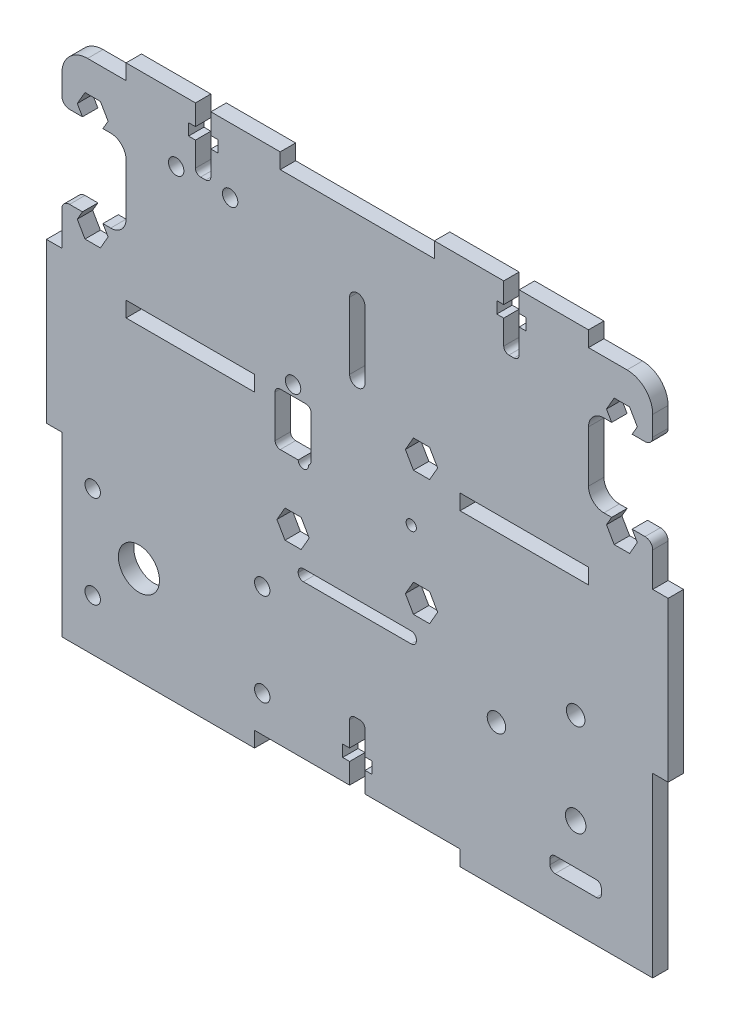
from build123d import *

# Parameters (mm, degrees)
ESBO_O1_W                   = 115
ESBO_O1_H                   = 100
RESSALTO_EXTRUS_O1_DEPTH    = 1.5
ESBO_O2_W                   = 40
ESBO_O2_H                   = 3
ESBO_O2_W_2                 = 25
CORTE_EXTRUS_O1_DEPTH       = 77.257786488
CUT_EXTRUDE12_DEPTH         = 77.213515862
CUT_EXTRUDE12_DEPTH_BACK    = 77.213515862
ESBO_O3_W                   = 3
ESBO_O3_H                   = 31
ESBO_O3_W_2                 = 30
ESBO_O3_H_2                 = 3
RESSALTO_EXTRUS_O2_DEPTH    = 3
CORTE_EXTRUS_O11_DEPTH      = 81.487576681
CORTE_EXTRUS_O11_DEPTH_BACK = 81.487576681
ESBO_O30_R                  = 4
ESBO_O4_R                   = 2
CORTE_EXTRUS_O2_DEPTH       = 81.487576681
CORTE_EXTRUS_O12_DEPTH      = 81.487576681
CORTE_EXTRUS_O12_DEPTH_BACK = 81.487576681
ESBO_O31_R                  = 1.5
CUT_EXTRUDE14_DEPTH         = 81.445633816
CUT_EXTRUDE14_DEPTH_BACK    = 81.445633816
CUT_EXTRUDE16_DEPTH         = 81.445633816
CUT_EXTRUDE16_DEPTH_BACK    = 81.445633816
SKETCH13_R                  = 1.5
CORTE_EXTRUS_O13_DEPTH      = 81.487576681
CORTE_EXTRUS_O13_DEPTH_BACK = 81.487576681
ESBO_O34_R                  = 1
CUT_EXTRUDE15_DEPTH         = 81.487576681
SKETCH12_3_W                = 4
SKETCH12_3_H                = 0.5
CUT_EXTRUDE18_DEPTH         = 0.1
FILLET1_R                   = 5
CUT_EXTRUDE17_DEPTH         = 81.445633816
CUT_EXTRUDE17_DEPTH_BACK    = 81.445633816
SKETCH14_R                  = 1.5
CUT_EXTRUDE19_DEPTH         = 81.487576681
CUT_EXTRUDE19_DEPTH_BACK    = 81.487576681
FILLET3_R                   = 1.5
CUT_EXTRUDE20_DEPTH         = 81.487576681
CUT_EXTRUDE20_DEPTH_BACK    = 81.487576681
SKETCH17_R                  = 1.8


with BuildPart() as part:
    # Esboço1 → Ressalto-extrusão1 (new, symmetric)
    with BuildSketch(Plane.XY):
        Rectangle(ESBO_O1_W, ESBO_O1_H)
    extrude(amount=RESSALTO_EXTRUS_O1_DEPTH, both=True)

    # Esboço2 → Corte-extrusão1 (cut, through all)
    with BuildSketch(Plane.XY.offset(1.5)):
        with Locations((0, -48.5)):
            Rectangle(ESBO_O2_W, ESBO_O2_H)
        with Locations((-32.5, 11.5)):
            Rectangle(ESBO_O2_W_2, ESBO_O2_H)
        with Locations((32.5, 11.5)):
            Rectangle(ESBO_O2_W_2, ESBO_O2_H)
    extrude(amount=-CORTE_EXTRUS_O1_DEPTH, mode=Mode.SUBTRACT)

    # Sketch9 → Cut-Extrude12 (cut, two sides: drawn at the far end of the back side and taken through both)
    with BuildSketch(Plane.XY.offset(-CUT_EXTRUDE12_DEPTH_BACK)):
        with BuildLine():
            Line((-1.5, -47), (1.5, -47))
            Line((1.5, -47), (1.5, -43))
            Line((1.5, -43), (2.85, -43))
            Line((2.85, -43), (2.85, -40.73))
            Line((2.85, -40.73), (1.5, -40.73))
            Line((1.5, -40.73), (1.5, -36))
            ThreePointArc((1.5, -36), (1.207106781, -35.292893219), (0.5, -35))
            Line((0.5, -35), (-0.5, -35))
            ThreePointArc((-0.5, -35), (-1.207106781, -35.292893219), (-1.5, -36))
            Line((-1.5, -36), (-1.5, -40.73))
            Line((-1.5, -40.73), (-2.85, -40.73))
            Line((-2.85, -40.73), (-2.85, -43))
            Line((-2.85, -43), (-1.5, -43))
            Line((-1.5, -43), (-1.5, -47))
        make_face()
    extrude(amount=CUT_EXTRUDE12_DEPTH + CUT_EXTRUDE12_DEPTH_BACK, mode=Mode.SUBTRACT)

    # Esboço3 → Ressalto-extrusão2 (add, through all)
    with BuildSketch(Plane.XY.offset(1.5)):
        with Locations((59, 0)):
            Rectangle(ESBO_O3_W, ESBO_O3_H)
        with Locations((-59, 0)):
            Rectangle(ESBO_O3_W, ESBO_O3_H)
        with Locations((-30, 51.5)):
            Rectangle(ESBO_O3_W_2, ESBO_O3_H_2)
        with Locations((30, 51.5)):
            Rectangle(ESBO_O3_W_2, ESBO_O3_H_2)
    extrude(amount=-RESSALTO_EXTRUS_O2_DEPTH)

    # Esboço30 → Corte-extrusão11 (cut, two sides: drawn at the far end of the back side and taken through both)
    with BuildSketch(Plane(origin=(0, 0, -1.5), x_dir=(-1, 0, 0), z_dir=(0, 0, -1)).offset(-CORTE_EXTRUS_O11_DEPTH_BACK)):
        with Locations((42.5, -31)):
            Circle(ESBO_O30_R)
    extrude(amount=CORTE_EXTRUS_O11_DEPTH + CORTE_EXTRUS_O11_DEPTH_BACK, mode=Mode.SUBTRACT)

    # Esboço4 → Corte-extrusão2 (cut, through all)
    with BuildSketch(Plane.XY.offset(1.5)):
        with Locations((42.5, -31)):
            Circle(ESBO_O4_R)
    extrude(amount=-CORTE_EXTRUS_O2_DEPTH, mode=Mode.SUBTRACT)

    # Esboço31 → Corte-extrusão12 (cut, two sides: drawn at the far end of the back side and taken through both)
    with BuildSketch(Plane(origin=(0, 0, -1.5), x_dir=(-1, 0, 0), z_dir=(0, 0, -1)).offset(-CORTE_EXTRUS_O12_DEPTH_BACK)):
        with Locations((51.5, -22)):
            Circle(ESBO_O31_R)
        with Locations((51.5, -40)):
            Circle(ESBO_O31_R)
        with Locations((18.5, -22)):
            Circle(ESBO_O31_R)
        with Locations((18.5, -40)):
            Circle(ESBO_O31_R)
    extrude(amount=CORTE_EXTRUS_O12_DEPTH + CORTE_EXTRUS_O12_DEPTH_BACK, mode=Mode.SUBTRACT)

    # Sketch11 → Cut-Extrude14 (cut, two sides: drawn at the far end of the back side and taken through both)
    with BuildSketch(Plane.XY.offset(-CUT_EXTRUDE14_DEPTH_BACK)):
        with BuildLine():
            Line((28.5, 53), (31.5, 53))
            Line((31.5, 53), (31.5, 49))
            Line((31.5, 49), (32.85, 49))
            Line((32.85, 49), (32.85, 46.73))
            Line((32.85, 46.73), (31.5, 46.73))
            Line((31.5, 46.73), (31.5, 42))
            ThreePointArc((31.5, 42), (31.207106781, 41.292893219), (30.5, 41))
            Line((30.5, 41), (29.5, 41))
            ThreePointArc((29.5, 41), (28.792893219, 41.292893219), (28.5, 42))
            Line((28.5, 42), (28.5, 46.73))
            Line((28.5, 46.73), (27.15, 46.73))
            Line((27.15, 46.73), (27.15, 49))
            Line((27.15, 49), (28.5, 49))
            Line((28.5, 49), (28.5, 53))
        make_face()
        with BuildLine():
            Line((-31.5, 46.73), (-32.85, 46.73))
            Line((-32.85, 46.73), (-32.85, 49))
            Line((-32.85, 49), (-31.5, 49))
            Line((-31.5, 49), (-31.5, 53))
            Line((-31.5, 53), (-28.5, 53))
            Line((-28.5, 53), (-28.5, 49))
            Line((-28.5, 49), (-27.15, 49))
            Line((-27.15, 49), (-27.15, 46.73))
            Line((-27.15, 46.73), (-28.5, 46.73))
            Line((-28.5, 46.73), (-28.5, 42))
            ThreePointArc((-28.5, 42), (-28.792893219, 41.292893219), (-29.5, 41))
            Line((-29.5, 41), (-30.5, 41))
            ThreePointArc((-30.5, 41), (-31.207106781, 41.292893219), (-31.5, 42))
            Line((-31.5, 42), (-31.5, 46.73))
        make_face()
    extrude(amount=CUT_EXTRUDE14_DEPTH + CUT_EXTRUDE14_DEPTH_BACK, mode=Mode.SUBTRACT)

    # Sketch13 → Cut-Extrude16 (cut, two sides: drawn at the far end of the back side and taken through both)
    with BuildSketch(Plane.XY.offset(-CUT_EXTRUDE16_DEPTH_BACK)):
        with Locations((-12.5, 15.019319768)):
            Circle(SKETCH13_R)
        with BuildLine():
            Line((-10, 13.019319768), (-15, 13.019319768))
            ThreePointArc((-15, 13.019319768), (-15.707106781, 12.726426549), (-16, 12.019319768))
            Line((-16, 12.019319768), (-16, 3.819319768))
            ThreePointArc((-16, 3.819319768), (-15.707106781, 3.112212987), (-15, 2.819319768))
            Line((-15, 2.819319768), (-10, 2.819319768))
            ThreePointArc((-10, 2.819319768), (-9.292893219, 3.112212987), (-9, 3.819319768))
            Line((-9, 3.819319768), (-9, 12.019319768))
            ThreePointArc((-9, 12.019319768), (-9.292893219, 12.726426549), (-10, 13.019319768))
        make_face()
        Polygon((15.64, 15.019319768), (14.07, 17.738639536), (10.93, 17.738639536), (9.36, 15.019319768), (10.93, 12.3), (14.07, 12.3), align=None)
        Polygon((15.64, -9.280680232), (14.07, -6.561360464), (10.93, -6.561360464), (9.36, -9.280680232), (10.93, -12), (14.07, -12), align=None)
        Polygon((-9.36, -9.280680232), (-10.93, -6.561360464), (-14.07, -6.561360464), (-15.64, -9.280680232), (-14.07, -12), (-10.93, -12), align=None)
    extrude(amount=CUT_EXTRUDE16_DEPTH + CUT_EXTRUDE16_DEPTH_BACK, mode=Mode.SUBTRACT)

    # Esboço34 → Corte-extrusão13 (cut, two sides: drawn at the far end of the back side and taken through both)
    with BuildSketch(Plane(origin=(0, 0, -1.5), x_dir=(-1, 0, 0), z_dir=(0, 0, -1)).offset(-CORTE_EXTRUS_O13_DEPTH_BACK)):
        with Locations((10.5, 2.82)):
            Circle(ESBO_O34_R)
        with Locations((-10.5, 2.82)):
            Circle(ESBO_O34_R)
        with BuildLine():
            Line((11.5, -16), (11.5, -16.2))
            ThreePointArc((11.5, -16.2), (11.207106781, -16.907106781), (10.5, -17.2))
            Line((10.5, -17.2), (-10.5, -17.2))
            ThreePointArc((-10.5, -17.2), (-11.207106781, -16.907106781), (-11.5, -16.2))
            Line((-11.5, -16.2), (-11.5, -16))
            ThreePointArc((-11.5, -16), (-11.207106781, -15.292893219), (-10.5, -15))
            Line((-10.5, -15), (10.5, -15))
            ThreePointArc((10.5, -15), (11.207106781, -15.292893219), (11.5, -16))
        make_face()
    extrude(amount=CORTE_EXTRUS_O13_DEPTH + CORTE_EXTRUS_O13_DEPTH_BACK, mode=Mode.SUBTRACT)

    # Sketch12 → Cut-Extrude15 (cut, through all)
    with BuildSketch(Plane.XY.offset(-1.5)):
        with BuildLine():
            Line((1.5, 22.238639536), (1.5, 35.238639536))
            ThreePointArc((1.5, 35.238639536), (0, 36.738639536), (-1.5, 35.238639536))
            Line((-1.5, 35.238639536), (-1.5, 22.238639536))
            ThreePointArc((-1.5, 22.238639536), (0, 20.738639536), (1.5, 22.238639536))
        make_face()
        with BuildLine():
            ThreePointArc((1.5, 35.238639536), (0, 36.738639536), (-1.5, 35.238639536))
            Line((-1.5, 35.238639536), (-1.5, 22.238639536))
            ThreePointArc((-1.5, 22.238639536), (0, 20.738639536), (1.5, 22.238639536))
            Line((1.5, 22.238639536), (1.5, 35.238639536))
        make_face()
    extrude(amount=CUT_EXTRUDE15_DEPTH, mode=Mode.SUBTRACT)

    # Sketch12<3> → Cut-Extrude18 (cut)
    with BuildSketch(Plane.XY.offset(-1.5)):
        with Locations((-4, 34.988639536)):
            Rectangle(SKETCH12_3_W, SKETCH12_3_H)
        with Locations((-4, 33.946972869)):
            Rectangle(SKETCH12_3_W, SKETCH12_3_H)
        with Locations((-4, 32.905306202)):
            Rectangle(SKETCH12_3_W, SKETCH12_3_H)
        with Locations((-4, 31.863639536)):
            Rectangle(SKETCH12_3_W, SKETCH12_3_H)
        with Locations((-4, 29.780306202)):
            Rectangle(SKETCH12_3_W, SKETCH12_3_H)
        with Locations((-4, 30.821972869)):
            Rectangle(SKETCH12_3_W, SKETCH12_3_H)
        with Locations((-4, 27.696972869)):
            Rectangle(SKETCH12_3_W, SKETCH12_3_H)
        with Locations((-4, 28.738639536)):
            Rectangle(SKETCH12_3_W, SKETCH12_3_H)
        with Locations((-4, 26.655306202)):
            Rectangle(SKETCH12_3_W, SKETCH12_3_H)
        with Locations((-4, 25.613639536)):
            Rectangle(SKETCH12_3_W, SKETCH12_3_H)
        with Locations((-4, 24.571972869)):
            Rectangle(SKETCH12_3_W, SKETCH12_3_H)
        with Locations((-4, 23.530306202)):
            Rectangle(SKETCH12_3_W, SKETCH12_3_H)
        with Locations((-4, 22.488639536)):
            Rectangle(SKETCH12_3_W, SKETCH12_3_H)
    extrude(amount=CUT_EXTRUDE18_DEPTH, mode=Mode.SUBTRACT)

    # Fillet1
    fillet1_edges = [part.edges().sort_by_distance(p)[0] for p in [
        (-57.5, 50, 0),
        (57.5, 50, 0),
    ]]
    fillet(fillet1_edges, radius=FILLET1_R)

    # Sketch14 → Cut-Extrude17 (cut, two sides: drawn at the far end of the back side and taken through both)
    with BuildSketch(Plane.XY.offset(-CUT_EXTRUDE17_DEPTH_BACK)):
        with Locations((-24.75, 40.4)):
            Circle(SKETCH14_R)
        with Locations((-35.25, 40.4)):
            Circle(SKETCH14_R)
    extrude(amount=CUT_EXTRUDE17_DEPTH + CUT_EXTRUDE17_DEPTH_BACK, mode=Mode.SUBTRACT)

    # Sketch8 → Cut-Extrude19 (cut, two sides: drawn at the far end of the back side and taken through both)
    with BuildSketch(Plane(origin=(0, 0, -1.5), x_dir=(-1, 0, 0), z_dir=(0, 0, -1)).offset(-CUT_EXTRUDE19_DEPTH_BACK)):
        with BuildLine():
            Line((-57.5, 39.651923789), (-53.489637029, 39.651923789))
            Line((-53.489637029, 39.651923789), (-54.5, 41.401923789))
            Line((-54.5, 41.401923789), (-53, 44))
            Line((-53, 44), (-50, 44))
            Line((-50, 44), (-48.5, 41.401923789))
            Line((-48.5, 41.401923789), (-49.510362971, 39.651923789))
            Line((-49.510362971, 39.651923789), (-48, 39.651923789))
            ThreePointArc((-48, 39.651923789), (-45.878679656, 38.773244132), (-45, 36.651923789))
            Line((-45, 36.651923789), (-45, 26.651923789))
            ThreePointArc((-45, 26.651923789), (-45.878679656, 24.530603445), (-48, 23.651923789))
            Line((-48, 23.651923789), (-49.510362971, 23.651923789))
            Line((-49.510362971, 23.651923789), (-48.5, 21.901923789))
            Line((-48.5, 21.901923789), (-50, 19.303847577))
            Line((-50, 19.303847577), (-53, 19.303847577))
            Line((-53, 19.303847577), (-54.5, 21.901923789))
            Line((-54.5, 21.901923789), (-53.489637029, 23.651923789))
            Line((-53.489637029, 23.651923789), (-57.5, 23.651923789))
            Line((-57.5, 23.651923789), (-57.5, 39.651923789))
        make_face()
        with BuildLine():
            Line((57.5, 23.651923789), (57.5, 39.651923789))
            Line((57.5, 39.651923789), (53.489637029, 39.651923789))
            Line((53.489637029, 39.651923789), (54.5, 41.401923789))
            Line((54.5, 41.401923789), (53, 44))
            Line((53, 44), (50, 44))
            Line((50, 44), (48.5, 41.401923789))
            Line((48.5, 41.401923789), (49.510362971, 39.651923789))
            Line((49.510362971, 39.651923789), (48, 39.651923789))
            ThreePointArc((48, 39.651923789), (45.878679656, 38.773244132), (45, 36.651923789))
            Line((45, 36.651923789), (45, 26.651923789))
            ThreePointArc((45, 26.651923789), (45.878679656, 24.530603445), (48, 23.651923789))
            Line((48, 23.651923789), (49.510362971, 23.651923789))
            Line((49.510362971, 23.651923789), (48.5, 21.901923789))
            Line((48.5, 21.901923789), (50, 19.303847577))
            Line((50, 19.303847577), (53, 19.303847577))
            Line((53, 19.303847577), (54.5, 21.901923789))
            Line((54.5, 21.901923789), (53.489637029, 23.651923789))
            Line((53.489637029, 23.651923789), (57.5, 23.651923789))
        make_face()
    extrude(amount=CUT_EXTRUDE19_DEPTH + CUT_EXTRUDE19_DEPTH_BACK, mode=Mode.SUBTRACT)

    # Fillet3
    fillet3_edges = [part.edges().sort_by_distance(p)[0] for p in [
        (57.5, 23.651923789, 0),
        (57.5, 39.651923789, 0),
        (-57.5, 39.651923789, 0),
        (-57.5, 23.651923789, 0),
    ]]
    fillet(fillet3_edges, radius=FILLET3_R)

    # Sketch17 → Cut-Extrude20 (cut, two sides: drawn at the far end of the back side and taken through both)
    with BuildSketch(Plane(origin=(0, 0, -1.5), x_dir=(-1, 0, 0), z_dir=(0, 0, -1)).offset(-CUT_EXTRUDE20_DEPTH_BACK)):
        with Locations((-42.5, -13.2)):
            Circle(SKETCH17_R)
        with Locations((-27.084747813, -22.1)):
            Circle(SKETCH17_R)
        with BuildLine():
            Line((-46.5, -38.908712115), (-38.5, -38.908712115))
            ThreePointArc((-38.5, -38.908712115), (-37.792893219, -39.201605333), (-37.5, -39.908712115))
            Line((-37.5, -39.908712115), (-37.5, -40.908712115))
            ThreePointArc((-37.5, -40.908712115), (-37.792893219, -41.615818896), (-38.5, -41.908712115))
            Line((-38.5, -41.908712115), (-46.5, -41.908712115))
            ThreePointArc((-46.5, -41.908712115), (-47.207106781, -41.615818896), (-47.5, -40.908712115))
            Line((-47.5, -40.908712115), (-47.5, -39.908712115))
            ThreePointArc((-47.5, -39.908712115), (-47.207106781, -39.201605333), (-46.5, -38.908712115))
        make_face()
    extrude(amount=CUT_EXTRUDE20_DEPTH + CUT_EXTRUDE20_DEPTH_BACK, mode=Mode.SUBTRACT)


solid = part.part
